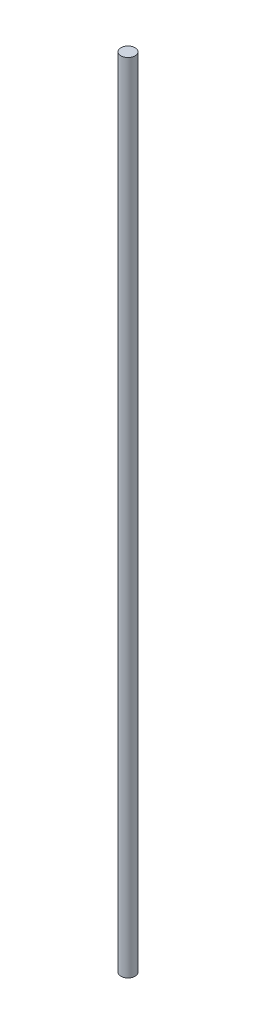
from build123d import *

# Parameters (mm, degrees)
SKETCH1_R        = 3.15
EXTRUSION1_DEPTH = 355.6


with BuildPart() as part:
    # Sketch1 → Extrusion1 (new body)
    with BuildSketch(Plane(origin=(0, 0, 0), x_dir=(-1, 0, 0), z_dir=(0, 1, 0))):
        with Locations(Location((0, 0, 0), (0, 0, 90))):
            Circle(SKETCH1_R)
    extrude(amount=EXTRUSION1_DEPTH)


solid = part.part
